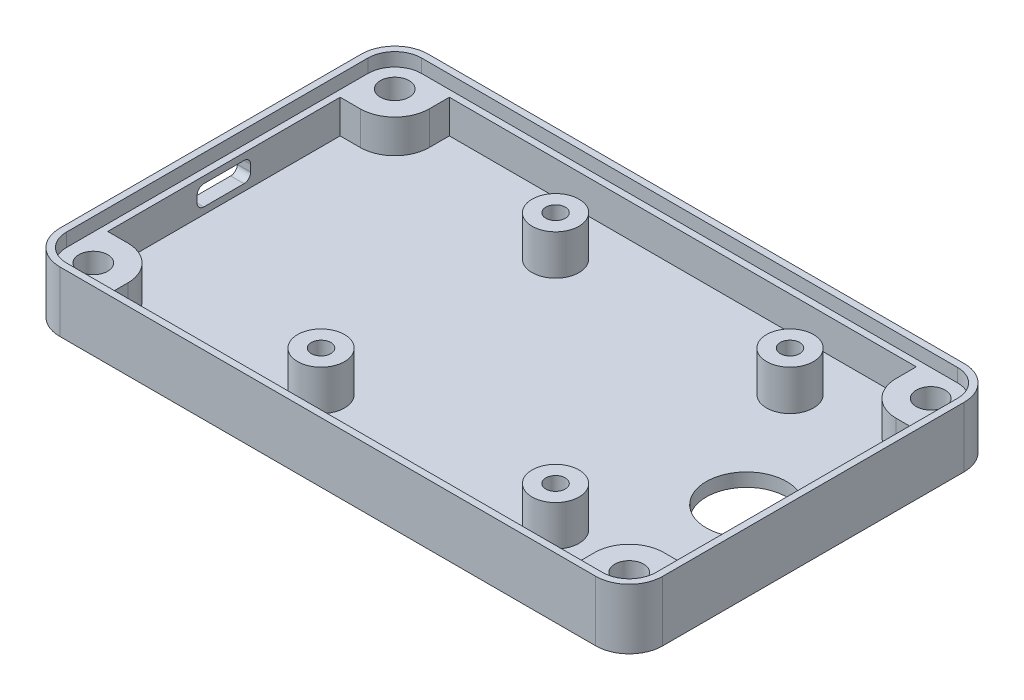
from build123d import *

# Parameters (mm, degrees)
ESQUISSE1_W             = 70
ESQUISSE1_H             = 55
ESQUISSE1_W_2           = 10
BOSS_EXTRU_1_DEPTH      = 2
ESQUISSE2_R             = 3.5
BOSS_EXTRU_2_DEPTH      = 6
ESQUISSE3_R             = 1.45
ENL_V_MAT_EXTRU_1_DEPTH = 4
ESQUISSE9_W             = 10
ESQUISSE9_H             = 55
BOSS_EXTRU_3_DEPTH      = 2
ESQUISSE10_R            = 6
ENL_V_MAT_EXTRU_8_DEPTH = 2
CONG_2_R                = 5
BOSS_EXTRU_4_DEPTH      = 5
BOSS_EXTRU_5_DEPTH      = 2
ESQUISSE15_R            = 2.15
BOSS_EXTRU_7_DEPTH      = 5
ESQUISSE17_W            = 8
ESQUISSE17_H            = 3
ENL_V_MAT_EXTRU_9_DEPTH = 10
CONG_3_R                = 1


with BuildPart() as part:
    # Esquisse1 → Boss.-Extru.1 (new body)
    with BuildSketch(Plane(origin=(0, 0, 0), x_dir=(1, 0, 0), z_dir=(0, 1, 0))):
        Rectangle(ESQUISSE1_W, ESQUISSE1_H)
        with Locations((-40, 0)):
            Rectangle(ESQUISSE1_W_2, ESQUISSE1_H)
    extrude(amount=BOSS_EXTRU_1_DEPTH)

    # Esquisse2 → Boss.-Extru.2 (add)
    with BuildSketch(Plane(origin=(0, 2, 0), x_dir=(1, 0, 0), z_dir=(0, 1, 0))):
        with Locations(Location((-11, 17.5, 0), (0, 0, 270))):
            Circle(ESQUISSE2_R)
        with Locations(Location((24, 17.5, 0), (0, 0, 270))):
            Circle(ESQUISSE2_R)
        with Locations(Location((24, -17.5, 0), (0, 0, 270))):
            Circle(ESQUISSE2_R)
        with Locations(Location((-11, -17.5, 0), (0, 0, 270))):
            Circle(ESQUISSE2_R)
    extrude(amount=BOSS_EXTRU_2_DEPTH)

    # Esquisse3 → Enlèv. mat.-Extru.1 (cut)
    with BuildSketch(Plane(origin=(0, 8, 0), x_dir=(1, 0, 0), z_dir=(0, 1, 0))):
        with Locations(Location((-11, 17.5, 0), (0, 0, 270))):
            Circle(ESQUISSE3_R)
        with Locations(Location((24, 17.5, 0), (0, 0, 270))):
            Circle(ESQUISSE3_R)
        with Locations(Location((24, -17.5, 0), (0, 0, 270))):
            Circle(ESQUISSE3_R)
        with Locations(Location((-11, -17.5, 0), (0, 0, 270))):
            Circle(ESQUISSE3_R)
    extrude(amount=-ENL_V_MAT_EXTRU_1_DEPTH, mode=Mode.SUBTRACT)

    # Esquisse9 → Boss.-Extru.3 (add)
    with BuildSketch(Plane(origin=(0, 2, 0), x_dir=(1, 0, 0), z_dir=(0, 1, 0))):
        with Locations((40, 0)):
            Rectangle(ESQUISSE9_W, ESQUISSE9_H)
    extrude(amount=-BOSS_EXTRU_3_DEPTH)

    # Esquisse10 → Enlèv. mat.-Extru.8 (cut)
    with BuildSketch(Plane(origin=(0, 2, 0), x_dir=(1, 0, 0), z_dir=(0, 1, 0))):
        with Locations(Location((35, 0, 0), (0, 0, 270))):
            Circle(ESQUISSE10_R)
    extrude(amount=-ENL_V_MAT_EXTRU_8_DEPTH, mode=Mode.SUBTRACT)

    # Congé2
    cong_2_edges = [part.edges().sort_by_distance(p)[0] for p in [
        (45, 1, -27.5),
        (45, 1, 27.5),
        (-45, 1, 27.5),
        (-45, 1, -27.5),
    ]]
    fillet(cong_2_edges, radius=CONG_2_R)

    # Esquisse12 → Boss.-Extru.4 (add)
    with BuildSketch(Plane(origin=(0, 2, 0), x_dir=(1, 0, 0), z_dir=(0, 1, 0))):
        with BuildLine():
            Line((40, 27.5), (-40, 27.5))
            ThreePointArc((-40, 27.5), (-43.535533906, 26.035533906), (-45, 22.5))
            Line((-45, 22.5), (-45, -22.5))
            ThreePointArc((-45, -22.5), (-43.535533906, -26.035533906), (-40, -27.5))
            Line((-40, -27.5), (40, -27.5))
            ThreePointArc((40, -27.5), (43.535533906, -26.035533906), (45, -22.5))
            Line((45, -22.5), (45, 22.5))
            ThreePointArc((45, 22.5), (43.535533906, 26.035533906), (40, 27.5))
        make_face()
        with BuildLine():
            Line((43, -22.5), (43, 22.5))
            ThreePointArc((43, 22.5), (42.121320344, 24.621320344), (40, 25.5))
            Line((40, 25.5), (-40, 25.5))
            ThreePointArc((-40, 25.5), (-42.121320344, 24.621320344), (-43, 22.5))
            Line((-43, 22.5), (-43, -22.5))
            ThreePointArc((-43, -22.5), (-42.121320344, -24.621320344), (-40, -25.5))
            Line((-40, -25.5), (40, -25.5))
            ThreePointArc((40, -25.5), (42.121320344, -24.621320344), (43, -22.5))
        make_face(mode=Mode.SUBTRACT)
    extrude(amount=BOSS_EXTRU_4_DEPTH)

    # Esquisse13 → Boss.-Extru.5 (add)
    with BuildSketch(Plane(origin=(0, 7, 0), x_dir=(1, 0, 0), z_dir=(0, 1, 0))):
        with BuildLine():
            Line((40, 27.5), (-40, 27.5))
            ThreePointArc((-40, 27.5), (-43.535533906, 26.035533906), (-45, 22.5))
            Line((-45, 22.5), (-45, -22.5))
            ThreePointArc((-45, -22.5), (-43.535533906, -26.035533906), (-40, -27.5))
            Line((-40, -27.5), (40, -27.5))
            ThreePointArc((40, -27.5), (43.535533906, -26.035533906), (45, -22.5))
            Line((45, -22.5), (45, 22.5))
            ThreePointArc((45, 22.5), (43.535533906, 26.035533906), (40, 27.5))
        make_face()
        with BuildLine():
            Line((40, 26.5), (-40, 26.5))
            ThreePointArc((-40, 26.5), (-42.828427125, 25.328427125), (-44, 22.5))
            Line((-44, 22.5), (-44, -22.5))
            ThreePointArc((-44, -22.5), (-42.828427125, -25.328427125), (-40, -26.5))
            Line((-40, -26.5), (40, -26.5))
            ThreePointArc((40, -26.5), (42.828427125, -25.328427125), (44, -22.5))
            Line((44, -22.5), (44, 22.5))
            ThreePointArc((44, 22.5), (42.828427125, 25.328427125), (40, 26.5))
        make_face(mode=Mode.SUBTRACT)
    extrude(amount=BOSS_EXTRU_5_DEPTH)

    # Esquisse15 → Boss.-Extru.7 (add)
    # profile 1 of 4: a face of its own
    with BuildSketch(Plane(origin=(0, 2, 0), x_dir=(1, 0, 0), z_dir=(0, 1, 0))):
        with BuildLine():
            ThreePointArc((-40, 17.35), (-36.358400077, 18.858400077), (-34.85, 22.5))
            Line((-34.85, 22.5), (-34.85, 25.5))
            Line((-34.85, 25.5), (-40, 25.5))
            ThreePointArc((-40, 25.5), (-42.121320344, 24.621320344), (-43, 22.5))
            Line((-43, 22.5), (-43, 17.35))
            Line((-43, 17.35), (-40, 17.35))
        make_face()
        with Locations(Location((-40, 22.5, 0), (0, 0, 270))):
            Circle(ESQUISSE15_R, mode=Mode.SUBTRACT)
    # profile 2 of 4: a face of its own
    with BuildSketch(Plane(origin=(0, 2, 0), x_dir=(1, 0, 0), z_dir=(0, 1, 0))):
        with BuildLine():
            Line((40, 25.5), (34.85, 25.5))
            Line((34.85, 25.5), (34.85, 22.5))
            ThreePointArc((34.85, 22.5), (36.358400077, 18.858400077), (40, 17.35))
            Line((40, 17.35), (43, 17.35))
            Line((43, 17.35), (43, 22.5))
            ThreePointArc((43, 22.5), (42.121320344, 24.621320344), (40, 25.5))
        make_face()
        with Locations(Location((40, 22.5, 0), (0, 0, 270))):
            Circle(ESQUISSE15_R, mode=Mode.SUBTRACT)
    # profile 3 of 4: a face of its own
    with BuildSketch(Plane(origin=(0, 2, 0), x_dir=(1, 0, 0), z_dir=(0, 1, 0))):
        with BuildLine():
            Line((43, -22.5), (43, -17.35))
            Line((43, -17.35), (40, -17.35))
            ThreePointArc((40, -17.35), (36.358400077, -18.858400077), (34.85, -22.5))
            Line((34.85, -22.5), (34.85, -25.5))
            Line((34.85, -25.5), (40, -25.5))
            ThreePointArc((40, -25.5), (42.121320344, -24.621320344), (43, -22.5))
        make_face()
        with Locations(Location((40, -22.5, 0), (0, 0, 270))):
            Circle(ESQUISSE15_R, mode=Mode.SUBTRACT)
    # profile 4 of 4: a face of its own
    with BuildSketch(Plane(origin=(0, 2, 0), x_dir=(1, 0, 0), z_dir=(0, 1, 0))):
        with BuildLine():
            Line((-40, -17.35), (-43, -17.35))
            Line((-43, -17.35), (-43, -22.5))
            ThreePointArc((-43, -22.5), (-42.121320344, -24.621320344), (-40, -25.5))
            Line((-40, -25.5), (-34.85, -25.5))
            Line((-34.85, -25.5), (-34.85, -22.5))
            ThreePointArc((-34.85, -22.5), (-36.358400077, -18.858400077), (-40, -17.35))
        make_face()
        with Locations(Location((-40, -22.5, 0), (0, 0, 270))):
            Circle(ESQUISSE15_R, mode=Mode.SUBTRACT)
    extrude(amount=BOSS_EXTRU_7_DEPTH)

    # Esquisse17 → Enlèv. mat.-Extru.9 (cut)
    with BuildSketch(Plane.ZY.offset(45)):
        with Locations((0, 4.5)):
            Rectangle(ESQUISSE17_W, ESQUISSE17_H)
    extrude(amount=-ENL_V_MAT_EXTRU_9_DEPTH, mode=Mode.SUBTRACT)

    # Congé3
    cong_3_edges = [part.edges().sort_by_distance(p)[0] for p in [
        (-44, 6, 4),
        (-44, 3, 4),
        (-44, 3, -4),
        (-44, 6, -4),
    ]]
    fillet(cong_3_edges, radius=CONG_3_R)


solid = part.part
